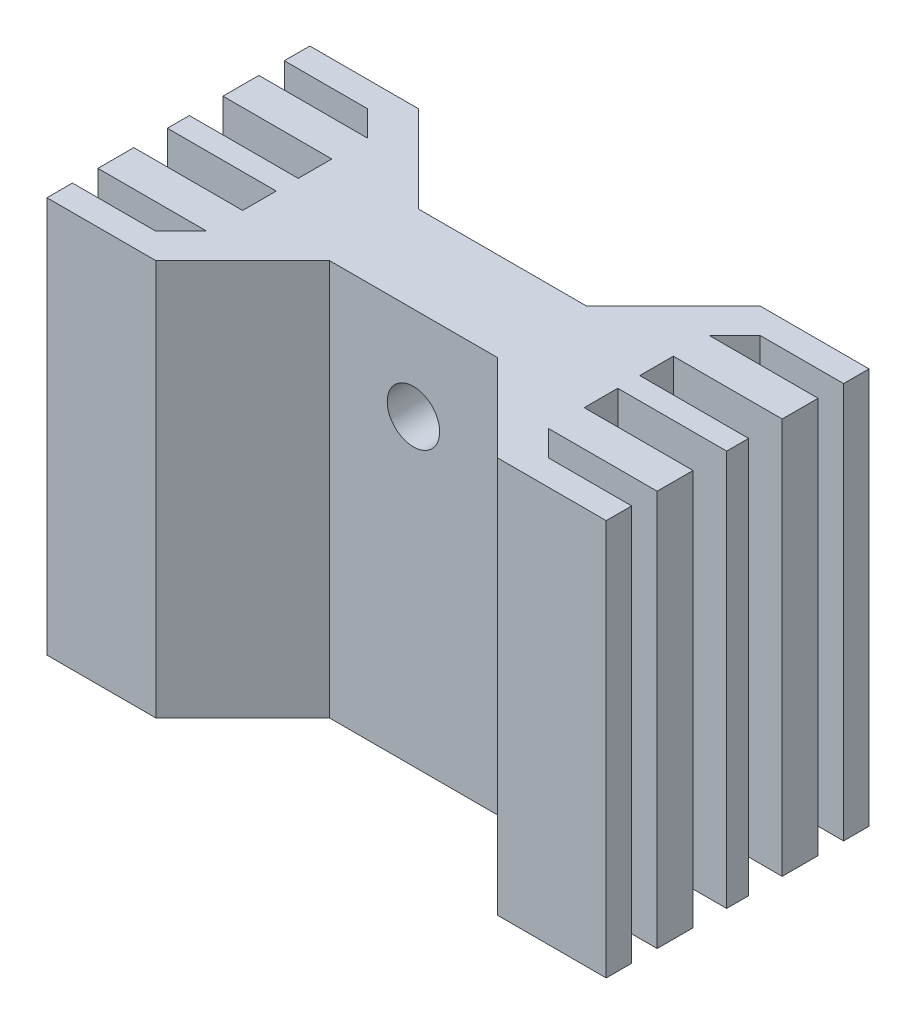
from build123d import *

# Parameters (mm, degrees)
BOSS_EXTRUDE1_DEPTH = 70
SKETCH3_R           = 4.630574493
CUT_EXTRUDE1_DEPTH  = 97.893202961


with BuildPart() as part:
    # Sketch1 → Boss-Extrude1 (new body)
    with BuildSketch(Plane(origin=(0, 0, 0), x_dir=(1, 0, 0), z_dir=(0, 1, 0))):
        Polygon((-59.338025707, 25.167507455), (-40.104320822, 25.167507455), (-24.758279691, 9.821466324), (4.910733162, 9.821466324), (20.256774293, 25.167507455), (39.490479177, 25.167507455), (39.490479177, 20.666002056), (24.758279691, 20.666002056), (20.256774293, 16.164496658), (39.490479177, 16.164496658), (39.490479177, 9.821466324), (20.256774293, 9.821466324), (20.256774293, 3.887663753), (39.490479177, 3.887663753), (39.490479177, 0), (20.256774293, 0), (20.256774293, -5.933802571), (39.490479177, -5.933802571), (39.490479177, -12.276832905), (20.256774293, -12.276832905), (24.758279691, -16.778338303), (39.490479177, -16.778338303), (39.490479177, -21.279843702), (20.256774293, -21.279843702), (4.910733162, -5.933802571), (-24.758279691, -5.933802571), (-40.104320822, -21.279843702), (-59.338025707, -21.279843702), (-59.338025707, -16.778338303), (-44.605826221, -16.778338303), (-40.104320822, -12.276832905), (-59.338025707, -12.276832905), (-59.338025707, -5.933802571), (-40.104320822, -5.933802571), (-40.104320822, 0), (-59.338025707, 0), (-59.338025707, 3.887663753), (-40.104320822, 3.887663753), (-40.104320822, 9.821466324), (-59.338025707, 9.821466324), (-59.338025707, 16.164496658), (-40.104320822, 16.164496658), (-44.605826221, 20.666002056), (-59.338025707, 20.666002056), align=None)
    extrude(amount=BOSS_EXTRUDE1_DEPTH)

    # Sketch3 → Cut-Extrude1 (cut, through all)
    with BuildSketch(Plane(origin=(0, 0, -9.821466324), x_dir=(-1, 0, 0), z_dir=(0, 0, -1))):
        with Locations((9.923773265, 53.534976089)):
            Circle(SKETCH3_R)
    extrude(amount=-CUT_EXTRUDE1_DEPTH, mode=Mode.SUBTRACT)


solid = part.part
